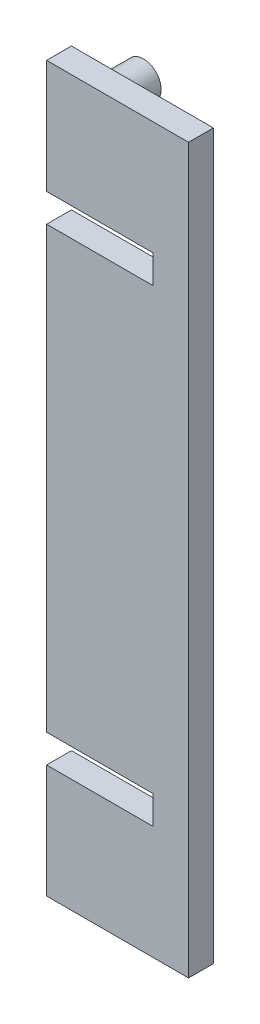
from build123d import *

# Parameters (mm, degrees)
EXTRUDE_1_DEPTH     = 3.5
SKETCH_2_W          = 60
SKETCH_2_H          = 102
CUT_EXTRUDE_1_DEPTH = 3.5
SKETCH_7_W          = 3.5
SKETCH_7_H          = 16
EXTRUDE_3_DEPTH     = 15
SKETCH_6_R          = 2.5
SKETCH_6_R_2        = 1.25
EXTRUDE_2_DEPTH     = 5


with BuildPart() as part:
    # 草图1 → 凸台-拉伸1 (new body)
    with BuildSketch(Plane.XY):
        Polygon((68.184988255, 39.174258776), (68.184988255, -22.825741224), (68.184988255, -42.825741224), (3.184988255, -42.825741224), (3.184988255, -22.825741224), (-11.815011745, -22.825741224), (-11.815011745, 39.174258776), (3.184988255, 39.174258776), (3.184988255, 59.174258776), (68.184988255, 59.174258776), align=None)
    extrude(amount=EXTRUDE_1_DEPTH)

    # 草图2 → 切除-拉伸1 (cut)
    with BuildSketch(Plane.XY.offset(3.5)):
        with Locations((38.184988255, 8.174258776)):
            Rectangle(SKETCH_2_W, SKETCH_2_H)
    extrude(amount=-CUT_EXTRUDE_1_DEPTH, mode=Mode.SUBTRACT)

    # 草图7 → 凸台-拉伸3 (add)
    with BuildSketch(Plane.ZY.offset(-3.184988255)):
        with Locations((1.75, 51.174258776)):
            Rectangle(SKETCH_7_W, SKETCH_7_H)
        with Locations((1.75, -34.825741224)):
            Rectangle(SKETCH_7_W, SKETCH_7_H)
    extrude(amount=EXTRUDE_3_DEPTH)

    # 草图6 → 凸台-拉伸2 (add)
    # profile 1 of 4: a face of its own
    with BuildSketch(Plane(origin=(0, 0, 0), x_dir=(-1, 0, 0), z_dir=(0, 0, -1))):
        with Locations(Location((6.668106828, -38.825741224, 0), (0, 0, 180))):
            Circle(SKETCH_6_R)
        with Locations((6.668106828, -38.825741224)):
            Circle(SKETCH_6_R_2, mode=Mode.SUBTRACT)
    # profile 2 of 4: a face of its own
    with BuildSketch(Plane(origin=(0, 0, 0), x_dir=(-1, 0, 0), z_dir=(0, 0, -1))):
        with Locations(Location((6.668106828, 1.174258776, 0), (0, 0, 180))):
            Circle(SKETCH_6_R)
        with Locations((6.668106828, 1.174258776)):
            Circle(SKETCH_6_R_2, mode=Mode.SUBTRACT)
    # profile 3 of 4: a face of its own
    with BuildSketch(Plane(origin=(0, 0, 0), x_dir=(-1, 0, 0), z_dir=(0, 0, -1))):
        with Locations(Location((6.668106828, 15.174258776, 0), (0, 0, 180))):
            Circle(SKETCH_6_R)
        with Locations((6.668106828, 15.174258776)):
            Circle(SKETCH_6_R_2, mode=Mode.SUBTRACT)
    # profile 4 of 4: a face of its own
    with BuildSketch(Plane(origin=(0, 0, 0), x_dir=(-1, 0, 0), z_dir=(0, 0, -1))):
        with Locations(Location((6.668106828, 55.174258776, 0), (0, 0, 180))):
            Circle(SKETCH_6_R)
        with Locations((6.668106828, 55.174258776)):
            Circle(SKETCH_6_R_2, mode=Mode.SUBTRACT)
    extrude(amount=EXTRUDE_2_DEPTH)


solid = part.part
